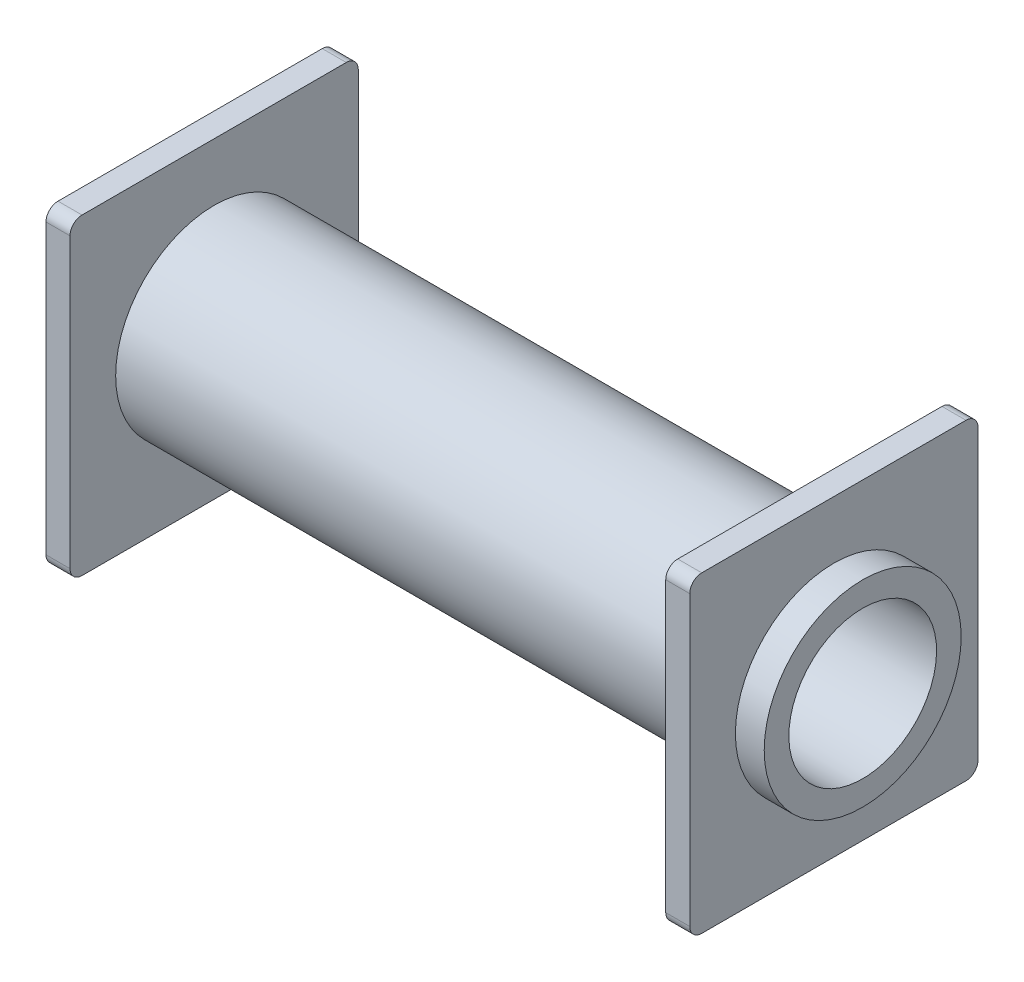
from build123d import *

# Parameters (mm, degrees)
CROQUIS1_W              = 28
CROQUIS1_H              = 4.1
CROQUIS3_W              = 12
CROQUIS3_H              = 13
SALIENTE_EXTRUIR1_DEPTH = 1
CROQUIS4_W              = 12
CROQUIS4_H              = 13
SALIENTE_EXTRUIR2_DEPTH = 1
REDONDEO1_R             = 0.5
CORTAR_EXTRUIR1_REACH   = 31.364
CROQUIS5_R              = 3.075


with BuildPart() as part:
    # Croquis1 → Revolución1 (revolve)
    with BuildSketch(Plane.XY, mode=Mode.PRIVATE) as revoluci_n1_sk:
        with Locations((0, 2.05)):
            Rectangle(CROQUIS1_W, CROQUIS1_H)
    revolve(revoluci_n1_sk.sketch.rotate(Axis((-14, 0, 0), (1, 0, 0)), 180), axis=Axis((-14, 0, 0), (1, 0, 0)))

    # Croquis3 → Saliente-Extruir1 (add)
    with BuildSketch(Plane(origin=(11.8, 0, 0), x_dir=(0, 0, -1), z_dir=(1, 0, 0))):
        Rectangle(CROQUIS3_W, CROQUIS3_H)
    extrude(amount=SALIENTE_EXTRUIR1_DEPTH)

    # Croquis4 → Saliente-Extruir2 (add)
    with BuildSketch(Plane.ZY.offset(14)):
        Rectangle(CROQUIS4_W, CROQUIS4_H)
    extrude(amount=-SALIENTE_EXTRUIR2_DEPTH)

    # Redondeo1
    redondeo1_edges = [part.edges().sort_by_distance(p)[0] for p in [
        (12.3, 6.5, 6),
        (12.3, -6.5, 6),
        (12.3, -6.5, -6),
        (12.3, 6.5, -6),
        (-13.5, -6.5, -6),
        (-13.5, 6.5, -6),
        (-13.5, 6.5, 6),
        (-13.5, -6.5, 6),
    ]]
    fillet(redondeo1_edges, radius=REDONDEO1_R)

    # Croquis5 → Cortar-Extruir1 (cut, up to next)
    with BuildSketch(Plane(origin=(14, 0, 0), x_dir=(0, 0, -1), z_dir=(1, 0, 0)), mode=Mode.PRIVATE) as cortar_extruir1_sk1:
        with Locations(Location((0, 0, 0), (0, 0, 90))):
            Circle(CROQUIS5_R)
    cortar_extruir1_tool1 = extrude(cortar_extruir1_sk1.sketch, amount=-CORTAR_EXTRUIR1_REACH, mode=Mode.PRIVATE) & part.part
    add(cortar_extruir1_tool1.solids().sort_by_distance((14, 0, 0))[0], mode=Mode.SUBTRACT)


solid = part.part
